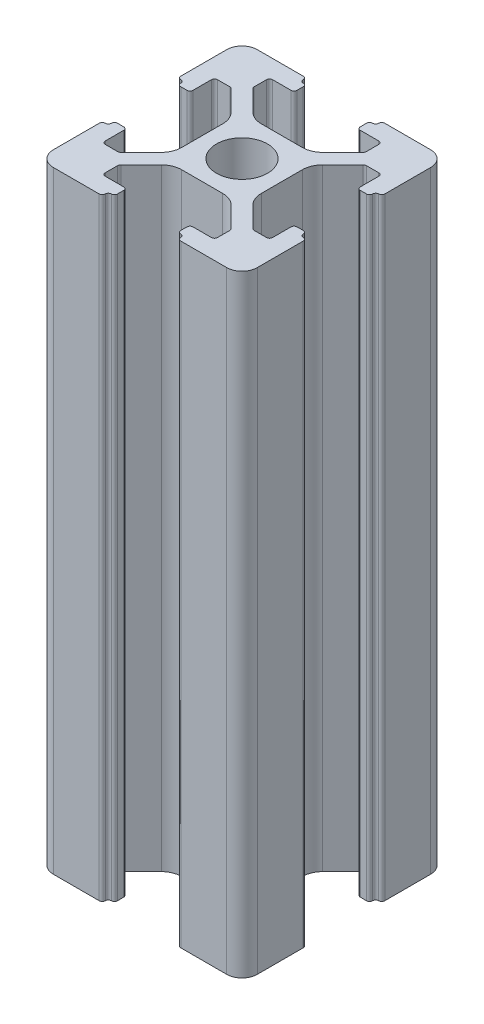
from build123d import *

# Parameters (mm, degrees)
SKETCH_1_R      = 2.5
EXTRUDE_1_DEPTH = 60


with BuildPart() as part:
    # 草图1 → 凸台-拉伸1 (new body)
    with BuildSketch(Plane(origin=(0, 0, 0), x_dir=(1, 0, 0), z_dir=(0, 1, 0))):
        with BuildLine():
            Line((10, 8.5), (10, 4))
            ThreePointArc((10, 4), (9.912132034, 3.787867966), (9.7, 3.7))
            ThreePointArc((9.7, 3.7), (9.487867966, 3.612132034), (9.4, 3.4))
            ThreePointArc((9.4, 3.4), (9.312132034, 3.187867966), (9.1, 3.1))
            Line((9.1, 3.1), (8.5, 3.1))
            ThreePointArc((8.5, 3.1), (8.287867966, 3.187867966), (8.2, 3.4))
            Line((8.2, 3.4), (8.2, 5.2))
            ThreePointArc((8.2, 5.2), (8.112132034, 5.412132034), (7.9, 5.5))
            Line((7.9, 5.5), (6.68492424, 5.5))
            ThreePointArc((6.68492424, 5.5), (6.570119211, 5.47716386), (6.472792206, 5.412132034))
            Line((6.472792206, 5.412132034), (4.485786438, 3.425126266))
            ThreePointArc((4.485786438, 3.425126266), (4.052240935, 2.776279568), (3.9, 2.010912703))
            Line((3.9, 2.010912703), (3.9, -2.010912703))
            ThreePointArc((3.9, -2.010912703), (4.052240935, -2.776279568), (4.485786438, -3.425126266))
            Line((4.485786438, -3.425126266), (6.472792206, -5.412132034))
            ThreePointArc((6.472792206, -5.412132034), (6.570119211, -5.47716386), (6.68492424, -5.5))
            Line((6.68492424, -5.5), (7.9, -5.5))
            ThreePointArc((7.9, -5.5), (8.112132034, -5.412132034), (8.2, -5.2))
            Line((8.2, -5.2), (8.2, -3.4))
            ThreePointArc((8.2, -3.4), (8.287867966, -3.187867966), (8.5, -3.1))
            Line((8.5, -3.1), (9.1, -3.1))
            ThreePointArc((9.1, -3.1), (9.312132034, -3.187867966), (9.4, -3.4))
            ThreePointArc((9.4, -3.4), (9.487867966, -3.612132034), (9.7, -3.7))
            ThreePointArc((9.7, -3.7), (9.912132034, -3.787867966), (10, -4))
            Line((10, -4), (10, -8.5))
            ThreePointArc((10, -8.5), (9.560660172, -9.560660172), (8.5, -10))
            Line((8.5, -10), (4, -10))
            ThreePointArc((4, -10), (3.787867966, -9.912132034), (3.7, -9.7))
            ThreePointArc((3.7, -9.7), (3.612132034, -9.487867966), (3.4, -9.4))
            ThreePointArc((3.4, -9.4), (3.187867966, -9.312132034), (3.1, -9.1))
            Line((3.1, -9.1), (3.1, -8.5))
            ThreePointArc((3.1, -8.5), (3.187867966, -8.287867966), (3.4, -8.2))
            Line((3.4, -8.2), (5.2, -8.2))
            ThreePointArc((5.2, -8.2), (5.412132034, -8.112132034), (5.5, -7.9))
            Line((5.5, -7.9), (5.5, -6.68492424))
            ThreePointArc((5.5, -6.68492424), (5.47716386, -6.570119211), (5.412132034, -6.472792206))
            Line((5.412132034, -6.472792206), (3.425126266, -4.485786438))
            ThreePointArc((3.425126266, -4.485786438), (2.776279568, -4.052240935), (2.010912703, -3.9))
            Line((2.010912703, -3.9), (-2.010912703, -3.9))
            ThreePointArc((-2.010912703, -3.9), (-2.776279568, -4.052240935), (-3.425126266, -4.485786438))
            Line((-3.425126266, -4.485786438), (-5.412132034, -6.472792206))
            ThreePointArc((-5.412132034, -6.472792206), (-5.47716386, -6.570119211), (-5.5, -6.68492424))
            Line((-5.5, -6.68492424), (-5.5, -7.9))
            ThreePointArc((-5.5, -7.9), (-5.412132034, -8.112132034), (-5.2, -8.2))
            Line((-5.2, -8.2), (-3.4, -8.2))
            ThreePointArc((-3.4, -8.2), (-3.187867966, -8.287867966), (-3.1, -8.5))
            Line((-3.1, -8.5), (-3.1, -9.1))
            ThreePointArc((-3.1, -9.1), (-3.187867966, -9.312132034), (-3.4, -9.4))
            ThreePointArc((-3.4, -9.4), (-3.612132034, -9.487867966), (-3.7, -9.7))
            ThreePointArc((-3.7, -9.7), (-3.787867966, -9.912132034), (-4, -10))
            Line((-4, -10), (-8.5, -10))
            ThreePointArc((-8.5, -10), (-9.560660172, -9.560660172), (-10, -8.5))
            Line((-10, -8.5), (-10, -4))
            ThreePointArc((-10, -4), (-9.912132034, -3.787867966), (-9.7, -3.7))
            ThreePointArc((-9.7, -3.7), (-9.487867966, -3.612132034), (-9.4, -3.4))
            ThreePointArc((-9.4, -3.4), (-9.312132034, -3.187867966), (-9.1, -3.1))
            Line((-9.1, -3.1), (-8.5, -3.1))
            ThreePointArc((-8.5, -3.1), (-8.287867966, -3.187867966), (-8.2, -3.4))
            Line((-8.2, -3.4), (-8.2, -5.2))
            ThreePointArc((-8.2, -5.2), (-8.112132034, -5.412132034), (-7.9, -5.5))
            Line((-7.9, -5.5), (-6.68492424, -5.5))
            ThreePointArc((-6.68492424, -5.5), (-6.570119211, -5.47716386), (-6.472792206, -5.412132034))
            Line((-6.472792206, -5.412132034), (-4.485786438, -3.425126266))
            ThreePointArc((-4.485786438, -3.425126266), (-4.052240935, -2.776279568), (-3.9, -2.010912703))
            Line((-3.9, -2.010912703), (-3.9, 2.010912703))
            ThreePointArc((-3.9, 2.010912703), (-4.052240935, 2.776279568), (-4.485786438, 3.425126266))
            Line((-4.485786438, 3.425126266), (-6.472792206, 5.412132034))
            ThreePointArc((-6.472792206, 5.412132034), (-6.570119211, 5.47716386), (-6.68492424, 5.5))
            Line((-6.68492424, 5.5), (-7.9, 5.5))
            ThreePointArc((-7.9, 5.5), (-8.112132034, 5.412132034), (-8.2, 5.2))
            Line((-8.2, 5.2), (-8.2, 3.4))
            ThreePointArc((-8.2, 3.4), (-8.287867966, 3.187867966), (-8.5, 3.1))
            Line((-8.5, 3.1), (-9.1, 3.1))
            ThreePointArc((-9.1, 3.1), (-9.312132034, 3.187867966), (-9.4, 3.4))
            ThreePointArc((-9.4, 3.4), (-9.487867966, 3.612132034), (-9.7, 3.7))
            ThreePointArc((-9.7, 3.7), (-9.912132034, 3.787867966), (-10, 4))
            Line((-10, 4), (-10, 8.5))
            ThreePointArc((-10, 8.5), (-9.560660172, 9.560660172), (-8.5, 10))
            Line((-8.5, 10), (-4, 10))
            ThreePointArc((-4, 10), (-3.787867966, 9.912132034), (-3.7, 9.7))
            ThreePointArc((-3.7, 9.7), (-3.612132034, 9.487867966), (-3.4, 9.4))
            ThreePointArc((-3.4, 9.4), (-3.187867966, 9.312132034), (-3.1, 9.1))
            Line((-3.1, 9.1), (-3.1, 8.5))
            ThreePointArc((-3.1, 8.5), (-3.187867966, 8.287867966), (-3.4, 8.2))
            Line((-3.4, 8.2), (-5.2, 8.2))
            ThreePointArc((-5.2, 8.2), (-5.412132034, 8.112132034), (-5.5, 7.9))
            Line((-5.5, 7.9), (-5.5, 6.68492424))
            ThreePointArc((-5.5, 6.68492424), (-5.47716386, 6.570119211), (-5.412132034, 6.472792206))
            Line((-5.412132034, 6.472792206), (-3.425126266, 4.485786438))
            ThreePointArc((-3.425126266, 4.485786438), (-2.776279568, 4.052240935), (-2.010912703, 3.9))
            Line((-2.010912703, 3.9), (2.010912703, 3.9))
            ThreePointArc((2.010912703, 3.9), (2.776279568, 4.052240935), (3.425126266, 4.485786438))
            Line((3.425126266, 4.485786438), (5.412132034, 6.472792206))
            ThreePointArc((5.412132034, 6.472792206), (5.47716386, 6.570119211), (5.5, 6.68492424))
            Line((5.5, 6.68492424), (5.5, 7.9))
            ThreePointArc((5.5, 7.9), (5.412132034, 8.112132034), (5.2, 8.2))
            Line((5.2, 8.2), (3.4, 8.2))
            ThreePointArc((3.4, 8.2), (3.187867966, 8.287867966), (3.1, 8.5))
            Line((3.1, 8.5), (3.1, 9.1))
            ThreePointArc((3.1, 9.1), (3.187867966, 9.312132034), (3.4, 9.4))
            ThreePointArc((3.4, 9.4), (3.612132034, 9.487867966), (3.7, 9.7))
            ThreePointArc((3.7, 9.7), (3.787867966, 9.912132034), (4, 10))
            Line((4, 10), (8.5, 10))
            ThreePointArc((8.5, 10), (9.560660172, 9.560660172), (10, 8.5))
        make_face()
        with Locations(Location((0, 0, 0), (0, 0, 270))):
            Circle(SKETCH_1_R, mode=Mode.SUBTRACT)
    extrude(amount=EXTRUDE_1_DEPTH)


solid = part.part
